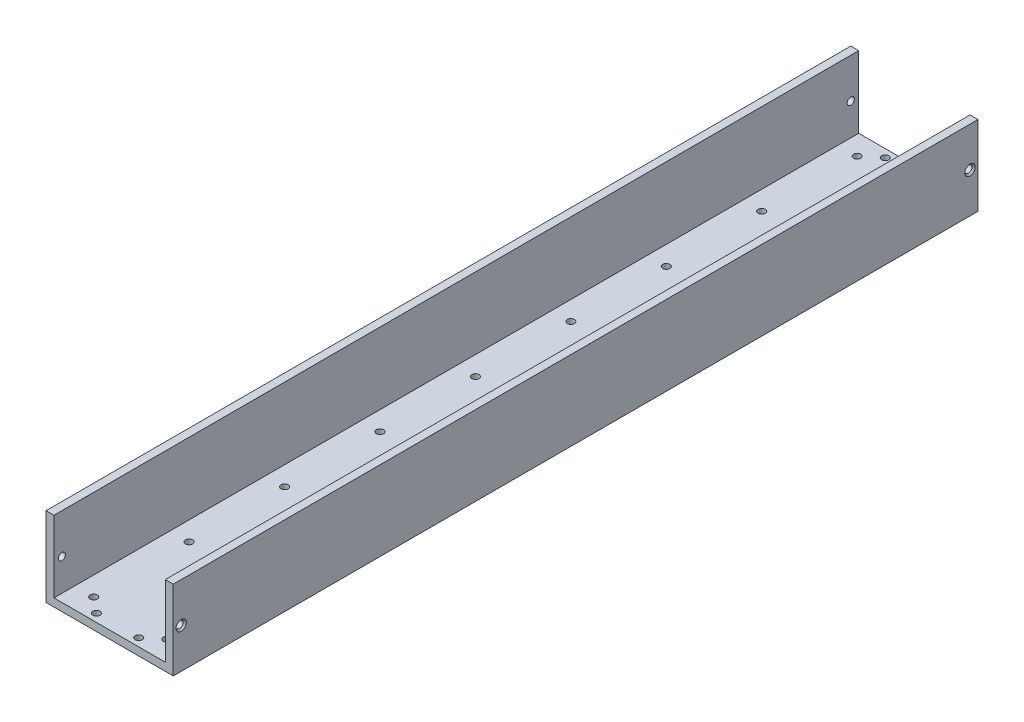
from build123d import *

# Parameters (mm, degrees)
ESTRUSIONE_ESTRUSIONE1_DEPTH = 506
SCHIZZO3_R                   = 2.25
TAGLIO_ESTRUSIONE1_DEPTH     = 515.719341001
SMUSSO1_SIZE                 = 1
SCHIZZO4_R                   = 2.25
TAGLIO_ESTRUSIONE2_DEPTH     = 515.719341001
SCHIZZO5_R                   = 2.25
TAGLIO_ESTRUSIONE3_DEPTH     = 515.719341001
SMUSSO2_SIZE                 = 1


with BuildPart() as part:
    # Schizzo1 → Estrusione-Estrusione1 (new body)
    with BuildSketch(Plane.XY):
        Polygon((75, 5), (75, 50), (80, 50), (80, 0), (0, 0), (0, 50), (5, 50), (5, 5), align=None)
    extrude(amount=-ESTRUSIONE_ESTRUSIONE1_DEPTH)

    # Schizzo3 → Taglio-Estrusione1 (cut, through all)
    with BuildSketch(Plane(origin=(80, 0, 0), x_dir=(0, 0, -1), z_dir=(1, 0, 0))):
        with Locations((5, 25)):
            Circle(SCHIZZO3_R)
        with Locations(Location((501, 25, 0), (0, 0, 180))):
            Circle(SCHIZZO3_R)
    extrude(amount=-TAGLIO_ESTRUSIONE1_DEPTH, mode=Mode.SUBTRACT)

    # Smusso1
    smusso1_edges = [part.edges().sort_by_distance(p)[0] for p in [
        (0, 25, -2.75),
        (80, 25, -2.75),
        (0, 25, -503.25),
        (80, 25, -503.25),
    ]]
    chamfer(smusso1_edges, length=SMUSSO1_SIZE)

    # Schizzo4 → Taglio-Estrusione2 (cut, through all)
    with BuildSketch(Plane.XZ):
        with Locations(Location((63, -253, 0), (0, 0, 270))):
            Circle(SCHIZZO4_R)
        with Locations(Location((63, -193, 0), (0, 0, 270))):
            Circle(SCHIZZO4_R)
        with Locations(Location((63, -133, 0), (0, 0, 270))):
            Circle(SCHIZZO4_R)
        with Locations(Location((63, -73, 0), (0, 0, 270))):
            Circle(SCHIZZO4_R)
        with Locations(Location((63, -13, 0), (0, 0, 270))):
            Circle(SCHIZZO4_R)
        with Locations(Location((63, -493, 0), (0, 0, 90))):
            Circle(SCHIZZO4_R)
        with Locations(Location((63, -433, 0), (0, 0, 90))):
            Circle(SCHIZZO4_R)
        with Locations(Location((63, -373, 0), (0, 0, 90))):
            Circle(SCHIZZO4_R)
        with Locations(Location((63, -313, 0), (0, 0, 90))):
            Circle(SCHIZZO4_R)
        with Locations(Location((17, -313, 0), (0, 0, 270))):
            Circle(SCHIZZO4_R)
        with Locations(Location((17, -373, 0), (0, 0, 270))):
            Circle(SCHIZZO4_R)
        with Locations(Location((17, -433, 0), (0, 0, 270))):
            Circle(SCHIZZO4_R)
        with Locations(Location((17, -493, 0), (0, 0, 270))):
            Circle(SCHIZZO4_R)
        with Locations(Location((17, -13, 0), (0, 0, 90))):
            Circle(SCHIZZO4_R)
        with Locations(Location((17, -73, 0), (0, 0, 90))):
            Circle(SCHIZZO4_R)
        with Locations(Location((17, -133, 0), (0, 0, 90))):
            Circle(SCHIZZO4_R)
        with Locations(Location((17, -193, 0), (0, 0, 90))):
            Circle(SCHIZZO4_R)
        with Locations(Location((17, -253, 0), (0, 0, 90))):
            Circle(SCHIZZO4_R)
    extrude(amount=-TAGLIO_ESTRUSIONE2_DEPTH, mode=Mode.SUBTRACT)

    # Schizzo5 → Taglio-Estrusione3 (cut, through all)
    with BuildSketch(Plane.XZ):
        with Locations(Location((26.7, -5, 0), (0, 0, 270))):
            Circle(SCHIZZO5_R)
        with Locations(Location((53.3, -5, 0), (0, 0, 270))):
            Circle(SCHIZZO5_R)
        with Locations(Location((53.3, -501, 0), (0, 0, 90))):
            Circle(SCHIZZO5_R)
        with Locations(Location((26.7, -501, 0), (0, 0, 90))):
            Circle(SCHIZZO5_R)
    extrude(amount=-TAGLIO_ESTRUSIONE3_DEPTH, mode=Mode.SUBTRACT)

    # Smusso2
    smusso2_edges = [part.edges().sort_by_distance(p)[0] for p in [
        (26.7, 0, -2.75),
        (53.3, 0, -2.75),
        (53.3, 0, -503.25),
        (26.7, 0, -503.25),
    ]]
    chamfer(smusso2_edges, length=SMUSSO2_SIZE)


solid = part.part
